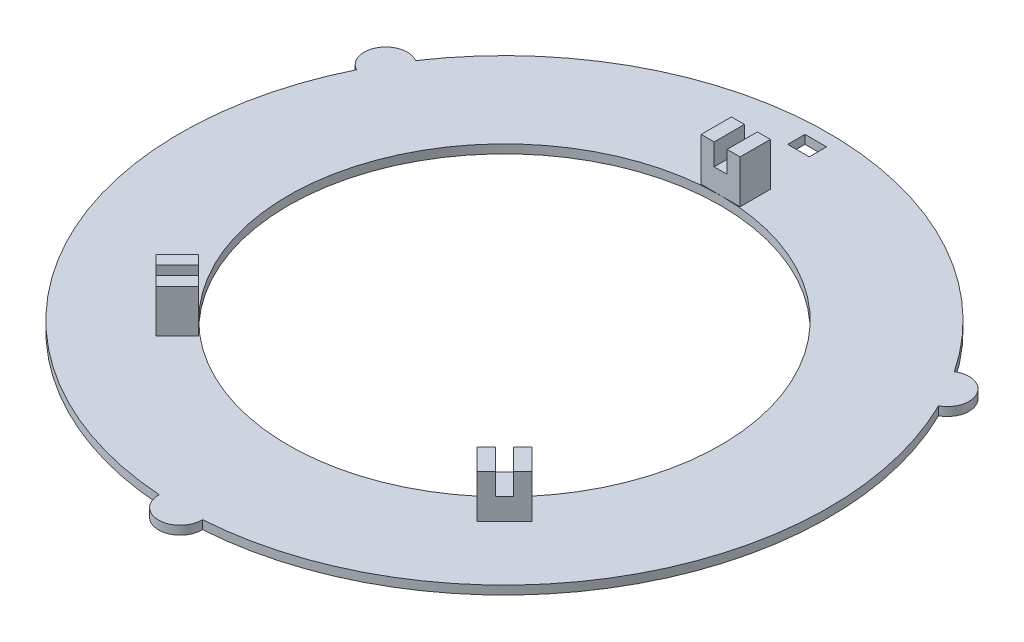
from build123d import *

# Parameters (mm, degrees)
SKETCH1_R           = 75
SKETCH1_R_2         = 50
BOSS_EXTRUDE1_DEPTH = 2
CUT_EXTRUDE1_REACH  = 108.085
SKETCH2_W           = 5
SKETCH2_H           = 4
SKETCH4_W           = 3
SKETCH4_H           = 7
BOSS_EXTRUDE2_DEPTH = 10
SKETCH5_W           = 3
SKETCH5_H           = 7
BOSS_EXTRUDE3_DEPTH = 5
CIRPATTERN1_COUNT   = 2
CIRPATTERN1_ANGLE   = 135
CIRPATTERN2_COUNT   = 2
CIRPATTERN2_ANGLE   = 135
SKETCH6_R           = 5
BOSS_EXTRUDE4_DEPTH = 2
CIRPATTERN3_COUNT   = 3


with BuildPart() as part:
    # Sketch1 → Boss-Extrude1 (new body)
    with BuildSketch(Plane(origin=(0, 0, 0), x_dir=(1, 0, 0), z_dir=(0, 1, 0))):
        with Locations(Location((0, 0, 0), (0, 0, 270))):
            Circle(SKETCH1_R)
        with Locations(Location((0, 0, 0), (0, 0, 270))):
            Circle(SKETCH1_R_2, mode=Mode.SUBTRACT)
    extrude(amount=BOSS_EXTRUDE1_DEPTH)

    # Sketch2 → Cut-Extrude1 (cut, up to next)
    with BuildSketch(Plane(origin=(0, 2, 0), x_dir=(1, 0, 0), z_dir=(0, 1, 0)), mode=Mode.PRIVATE) as cut_extrude1_sk1:
        with Locations((0, 70)):
            Rectangle(SKETCH2_W, SKETCH2_H)
    cut_extrude1_tool1 = extrude(cut_extrude1_sk1.sketch, amount=-CUT_EXTRUDE1_REACH, mode=Mode.PRIVATE) & part.part
    add(cut_extrude1_tool1.solids().sort_by_distance((0, 2, -70))[0], mode=Mode.SUBTRACT)

    # Sketch4 → Boss-Extrude2 (add)
    with BuildSketch(Plane(origin=(0, 2, 0), x_dir=(1, 0, 0), z_dir=(0, 1, 0))):
        with Locations((3, 53.5)):
            Rectangle(SKETCH4_W, SKETCH4_H)
        with Locations((-3, 53.5)):
            Rectangle(SKETCH4_W, SKETCH4_H)
    boss_extrude2 = extrude(amount=BOSS_EXTRUDE2_DEPTH)

    # Sketch5 → Boss-Extrude3 (add)
    with BuildSketch(Plane(origin=(0, 2, 0), x_dir=(1, 0, 0), z_dir=(0, 1, 0))):
        with Locations((0, 53.5)):
            Rectangle(SKETCH5_W, SKETCH5_H)
    boss_extrude3 = extrude(amount=BOSS_EXTRUDE3_DEPTH)

    # CirPattern1: Boss-Extrude2, Boss-Extrude3 ×2 about axis
    cirpattern1_axis = Axis((0, 2, 0), (0, 1, 0))
    add([boss_extrude2.rotate(cirpattern1_axis, i * CIRPATTERN1_ANGLE / (CIRPATTERN1_COUNT - 1)) for i in range(1, CIRPATTERN1_COUNT)])
    add([boss_extrude3.rotate(cirpattern1_axis, i * CIRPATTERN1_ANGLE / (CIRPATTERN1_COUNT - 1)) for i in range(1, CIRPATTERN1_COUNT)])

    # CirPattern2: Boss-Extrude2, Boss-Extrude3 ×2 about axis
    cirpattern2_axis = Axis((0, 0, 0), (0, -1, 0))
    add([boss_extrude2.rotate(cirpattern2_axis, i * CIRPATTERN2_ANGLE / (CIRPATTERN2_COUNT - 1)) for i in range(1, CIRPATTERN2_COUNT)])
    add([boss_extrude3.rotate(cirpattern2_axis, i * CIRPATTERN2_ANGLE / (CIRPATTERN2_COUNT - 1)) for i in range(1, CIRPATTERN2_COUNT)])

    # Sketch6 → Boss-Extrude4 (add)
    with BuildSketch(Plane.XZ):
        with Locations((64.951905284, -37.5)):
            Circle(SKETCH6_R)
    boss_extrude4 = extrude(amount=-BOSS_EXTRUDE4_DEPTH)

    # CirPattern3: Boss-Extrude4 ×3 about axis
    cirpattern3_axis = Axis((0, 0, 0), (0, 1, 0))
    for i in range(1, CIRPATTERN3_COUNT):
        add(boss_extrude4.rotate(cirpattern3_axis, i * 360 / CIRPATTERN3_COUNT))


solid = part.part
